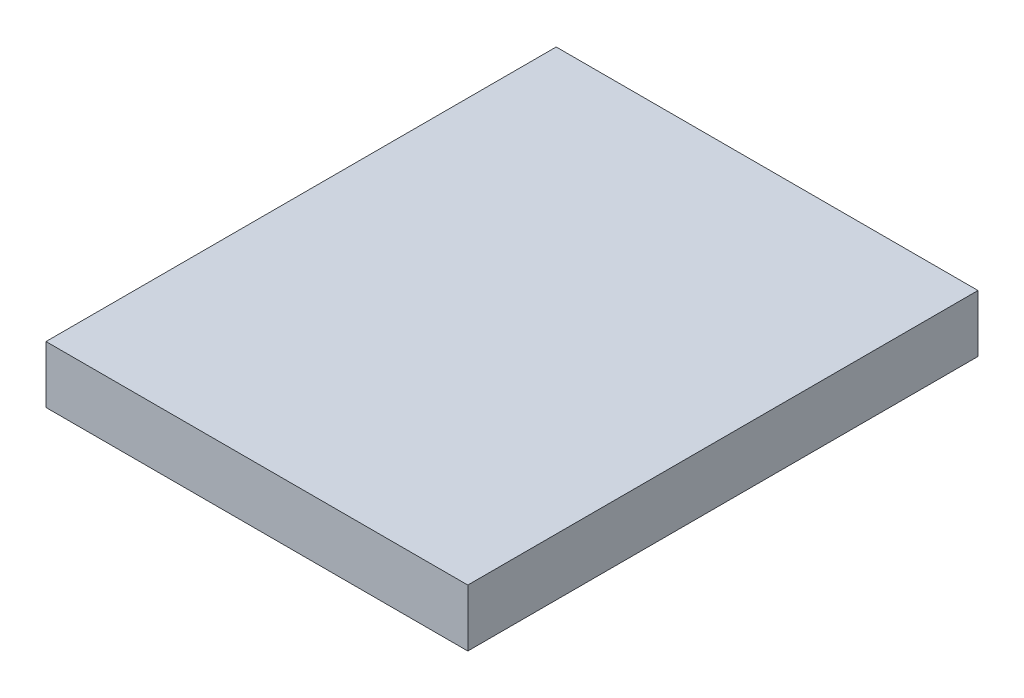
from build123d import *

# Parameters (mm, degrees)
SKETCH1_W           = 1106.97250468
SKETCH1_H           = 150
BOSS_EXTRUDE1_DEPTH = 669.5


with BuildPart() as part:
    # Sketch1 → Boss-Extrude1 (new, symmetric)
    with BuildSketch(Plane.XY):
        with Locations((553.48625234, 75)):
            Rectangle(SKETCH1_W, SKETCH1_H)
    extrude(amount=BOSS_EXTRUDE1_DEPTH, both=True)


solid = part.part
